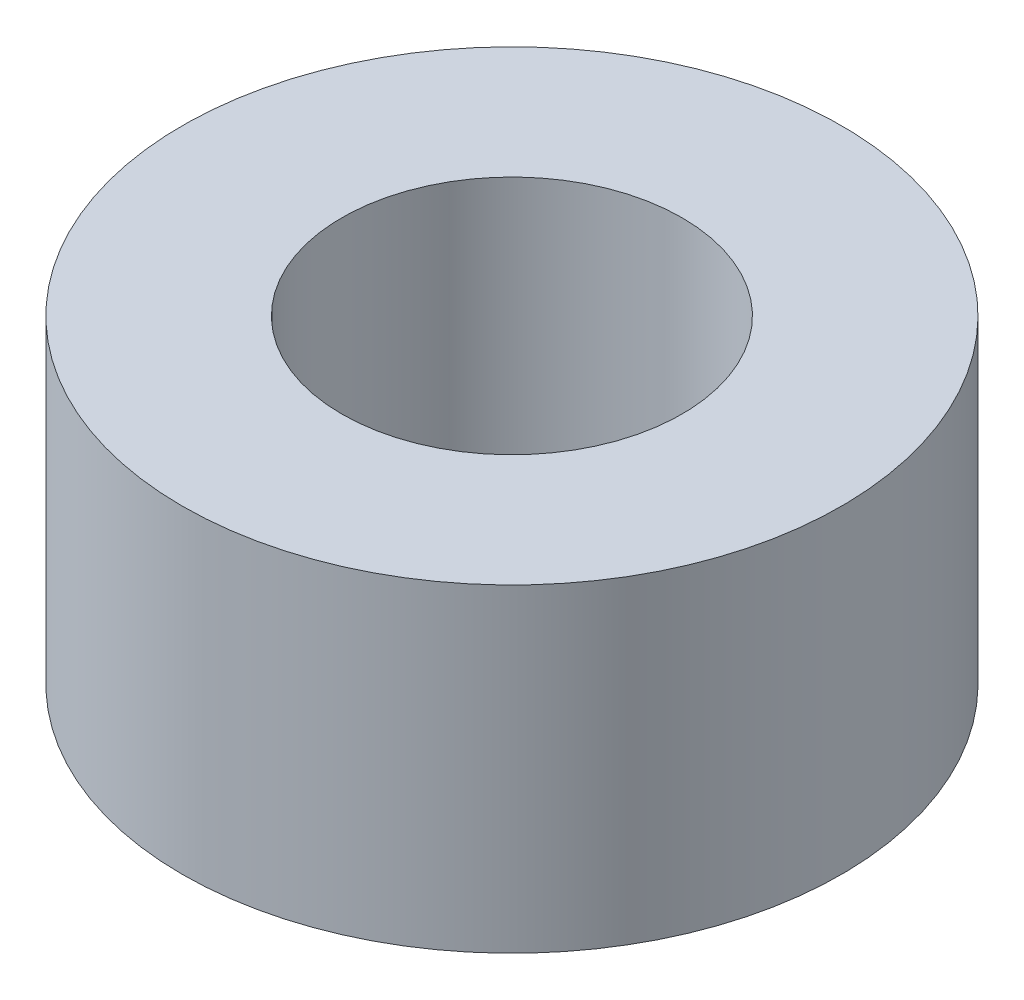
from build123d import *

# Parameters (mm, degrees)
ESQUISSE1_R        = 3.1
ESQUISSE1_R_2      = 1.6
BOSS_EXTRU_1_DEPTH = 3


with BuildPart() as part:
    # Esquisse1 → Boss.-Extru.1 (new body)
    with BuildSketch(Plane(origin=(0, 0, 0), x_dir=(1, 0, 0), z_dir=(0, 1, 0))):
        with Locations(Location((0, 0, 0), (0, 0, 270))):
            Circle(ESQUISSE1_R)
        with Locations(Location((0, 0, 0), (0, 0, 270))):
            Circle(ESQUISSE1_R_2, mode=Mode.SUBTRACT)
    extrude(amount=BOSS_EXTRU_1_DEPTH)


solid = part.part
